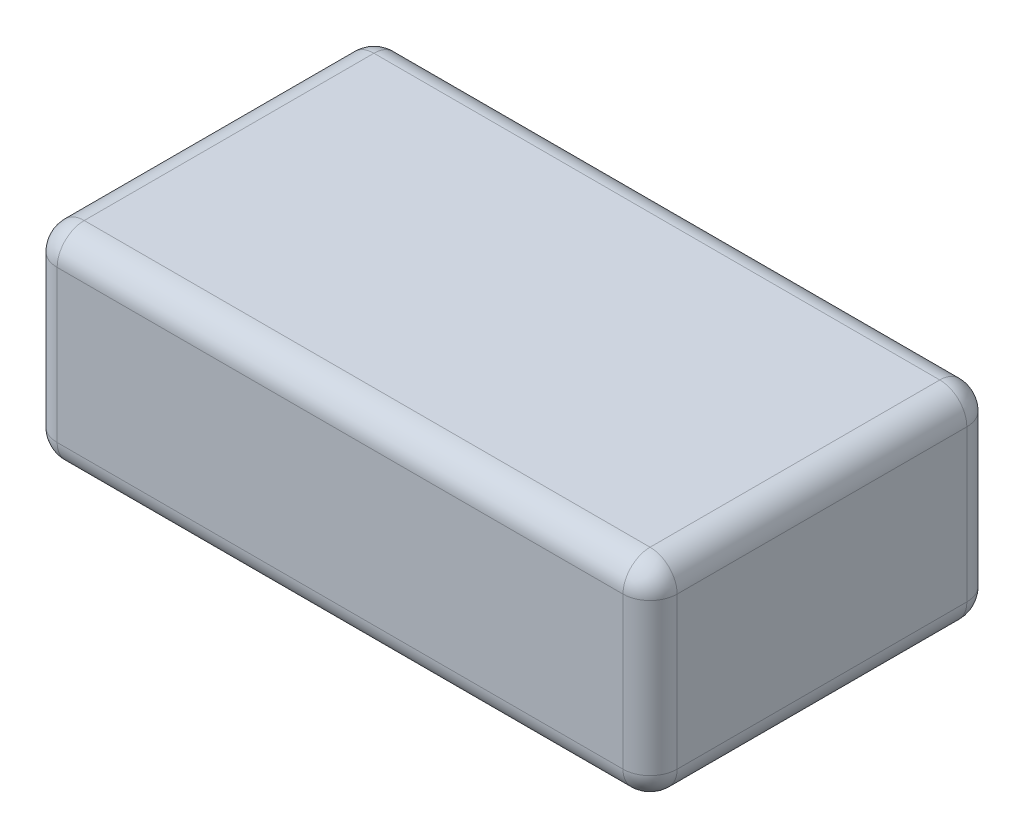
from build123d import *

# Parameters (mm, degrees)
SKETCH1_W           = 229
SKETCH1_H           = 127
BOSS_EXTRUDE1_DEPTH = 76
FILLET1_R           = 10


with BuildPart() as part:
    # Sketch1 → Boss-Extrude1 (new body)
    with BuildSketch(Plane(origin=(0, 0, 0), x_dir=(1, 0, 0), z_dir=(0, 1, 0))):
        with Locations((114.5, -63.5)):
            Rectangle(SKETCH1_W, SKETCH1_H)
    extrude(amount=BOSS_EXTRUDE1_DEPTH)

    # Fillet1
    fillet1_edges = [part.edges().sort_by_distance(p)[0] for p in [
        (229, 76, 63.5),
        (114.5, 76, 0),
        (0, 76, 63.5),
        (114.5, 0, 0),
        (229, 0, 63.5),
        (114.5, 0, 127),
        (0, 0, 63.5),
        (0, 38, 0),
        (229, 38, 0),
        (229, 38, 127),
        (0, 38, 127),
        (114.5, 76, 127),
    ]]
    fillet(fillet1_edges, radius=FILLET1_R)


solid = part.part
